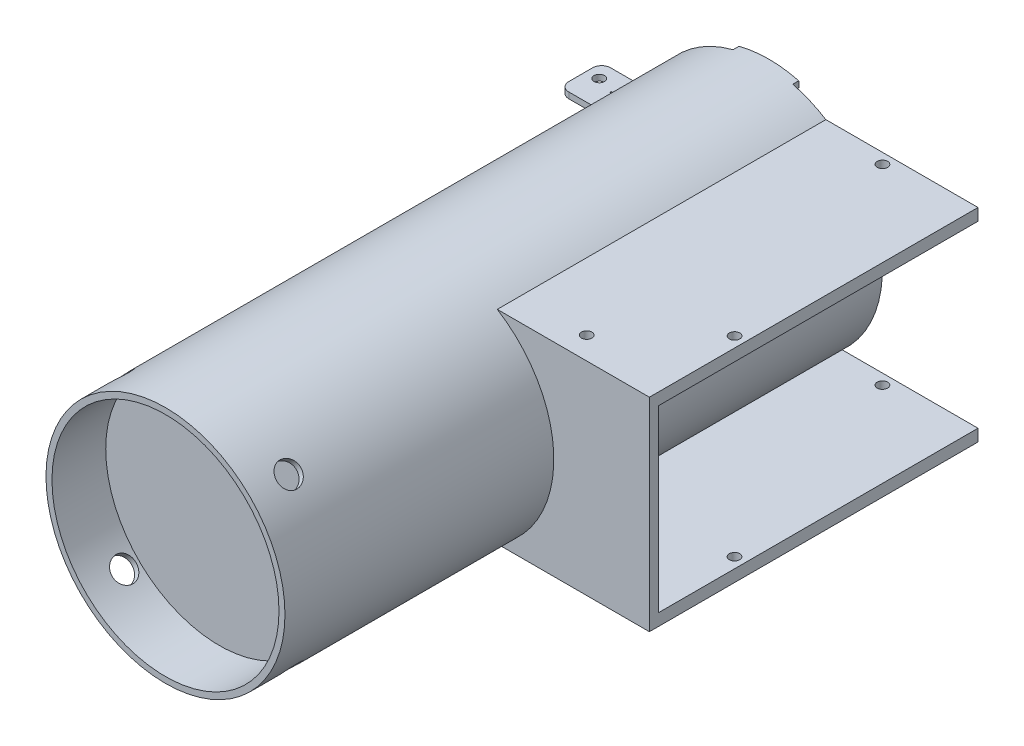
from build123d import *
from build123d.topology import SkipClean

# Parameters (mm, degrees)
SKETCH1_R                      = 40
SKETCH1_R_2                    = 38
BOSS_EXTRUDE1_DEPTH            = 200
SKETCH2_R                      = 40
BOSS_EXTRUDE2_DEPTH            = 2
BOSS_EXTRUDE3_DEPTH            = 107
BOSS_EXTRUDE4_DEPTH            = 3
SKETCH5_R                      = 1.75
CUT_EXTRUDE1_DEPTH             = 226.077764339
CUT_EXTRUDE2_REACH             = 218.296
SKETCH6_R                      = 4
CUT_EXTRUDE2_DIRECTION_2_REACH = 218.296
CIRPATTERN1_COUNT              = 2
CIRPATTERN1_ANGLE              = 90
BOSS_EXTRUDE5_REACH            = 241.742
BOSS_EXTRUDE5_END_RADIUS       = 40
SKETCH7_W                      = 14
SKETCH7_H                      = 2
CUT_EXTRUDE3_REACH             = 221.073
SKETCH8_R                      = 1.75
FILLET1_R                      = 3
CUT_EXTRUDE4_REACH             = 220.598
SKETCH9_R                      = 0.25
BOSS_EXTRUDE6_START            = 2
BOSS_EXTRUDE6_DEPTH            = 2


with BuildPart() as part:
    # Sketch1 → Boss-Extrude1 (new body)
    with BuildSketch(Plane.XY):
        Circle(SKETCH1_R)
        Circle(SKETCH1_R_2, mode=Mode.SUBTRACT)
    extrude(amount=BOSS_EXTRUDE1_DEPTH)

    # Sketch2 → Boss-Extrude2 (add)
    with BuildSketch(Plane.XY.offset(180)):
        Circle(SKETCH2_R)
    extrude(amount=BOSS_EXTRUDE2_DEPTH)

    # Sketch3 → Boss-Extrude3 (add)
    with BuildSketch(Plane(origin=(0, 0, 0), x_dir=(-1, 0, 0), z_dir=(0, 0, -1))):
        with BuildLine():
            Line((-21.071307506, -34), (-72, -34))
            Line((-72, -34), (-72, -30))
            Line((-72, -30), (-26.457513111, -30))
            ThreePointArc((-26.457513111, -30), (-23.848421275, -32.113125085), (-21.071307506, -34))
        make_face()
        with BuildLine():
            Line((-21.071307506, 34), (-72, 34))
            Line((-72, 34), (-72, 30))
            Line((-72, 30), (-26.457513111, 30))
            ThreePointArc((-26.457513111, 30), (-23.848421275, 32.113125085), (-21.071307506, 34))
        make_face()
    extrude(amount=-BOSS_EXTRUDE3_DEPTH)

    # Sketch4 → Boss-Extrude4 (add)
    with BuildSketch(Plane.XY.offset(107)):
        with BuildLine():
            Line((72, -34), (21.071307506, -34))
            ThreePointArc((21.071307506, -34), (40, 0), (21.071307506, 34))
            Line((21.071307506, 34), (72, 34))
            Line((72, 34), (72, -34))
        make_face()
    extrude(amount=BOSS_EXTRUDE4_DEPTH)

    # Sketch5 → Cut-Extrude1 (cut, through all)
    with BuildSketch(Plane(origin=(0, 34, 0), x_dir=(1, 0, 0), z_dir=(0, 1, 0))):
        with Locations(Location((43.5, -102.5, 0), (0, 0, 270))):
            Circle(SKETCH5_R)
        with Locations(Location((43.5, -3.5, 0), (0, 0, 270))):
            Circle(SKETCH5_R)
        with Locations(Location((68.5, -78, 0), (0, 0, 270))):
            Circle(SKETCH5_R)
    extrude(amount=-CUT_EXTRUDE1_DEPTH, mode=Mode.SUBTRACT)

    # Sketch6 → Cut-Extrude2 (cut, up to next)
    with BuildSketch(Plane(origin=(0, 0, 0), x_dir=(0, 0, 1), z_dir=(-0.7071067811865488, 0.7071067811865464, 0)), mode=Mode.PRIVATE) as cut_extrude2_sk1:
        with Locations(Location((187, 0, 0), (0, 0, 90))):
            Circle(SKETCH6_R)
    cut_extrude2_tool1 = extrude(cut_extrude2_sk1.sketch, amount=-CUT_EXTRUDE2_REACH, mode=Mode.PRIVATE) & part.part
    cut_extrude2 = cut_extrude2_tool1.solids().sort_by_distance((0, 0, 187))[0]
    add(cut_extrude2, mode=Mode.SUBTRACT)

    # Sketch6 → Cut-Extrude2 direction 2 (cut, up to next)
    with BuildSketch(Plane(origin=(0, 0, 0), x_dir=(0, 0, 1), z_dir=(-0.7071067811865488, 0.7071067811865464, 0)), mode=Mode.PRIVATE) as cut_extrude2_direction_2_sk1:
        with Locations(Location((187, 0, 0), (0, 0, 90))):
            Circle(SKETCH6_R)
    cut_extrude2_direction_2_tool1 = extrude(cut_extrude2_direction_2_sk1.sketch, amount=CUT_EXTRUDE2_DIRECTION_2_REACH, mode=Mode.PRIVATE) & part.part
    cut_extrude2_direction_2 = cut_extrude2_direction_2_tool1.solids().sort_by_distance((0, 0, 187))[0]
    add(cut_extrude2_direction_2, mode=Mode.SUBTRACT)

    # CirPattern1: Cut-Extrude2, Cut-Extrude2 direction 2 ×2 about axis
    cirpattern1_axis = Axis((0, 0, 106.8), (0, 0, 1))
    add([cut_extrude2.rotate(cirpattern1_axis, i * CIRPATTERN1_ANGLE / (CIRPATTERN1_COUNT - 1)) for i in range(1, CIRPATTERN1_COUNT)], mode=Mode.SUBTRACT)
    add([cut_extrude2_direction_2.rotate(cirpattern1_axis, i * CIRPATTERN1_ANGLE / (CIRPATTERN1_COUNT - 1)) for i in range(1, CIRPATTERN1_COUNT)], mode=Mode.SUBTRACT)

    # Boss-Extrude5: up to this cylinder (the profile starts outside it)
    boss_extrude5_end = Plane(origin=(0, 0, 7), z_dir=(0, 0, -1)) * Cylinder(BOSS_EXTRUDE5_END_RADIUS, 564.484, mode=Mode.PRIVATE)
    # Sketch7 → Boss-Extrude5 (add, up to the surface)
    with BuildSketch(Plane(origin=(-54, 0, 0), x_dir=(0, 0, -1), z_dir=(1, 0, 0)), mode=Mode.PRIVATE) as boss_extrude5_sk1:
        with Locations((-7, -12)):
            Rectangle(SKETCH7_W, SKETCH7_H)
    boss_extrude5_tool1 = extrude(boss_extrude5_sk1.sketch, amount=BOSS_EXTRUDE5_REACH, mode=Mode.PRIVATE) - boss_extrude5_end
    add(boss_extrude5_tool1.solids().sort_by_distance((-54, -12, 7))[0])
    # Sketch7 → Boss-Extrude5 (add, up to the surface)
    with BuildSketch(Plane(origin=(-54, 0, 0), x_dir=(0, 0, -1), z_dir=(1, 0, 0)), mode=Mode.PRIVATE) as boss_extrude5_sk2:
        with Locations((-7, 12)):
            Rectangle(SKETCH7_W, SKETCH7_H)
    boss_extrude5_tool2 = extrude(boss_extrude5_sk2.sketch, amount=BOSS_EXTRUDE5_REACH, mode=Mode.PRIVATE) - boss_extrude5_end
    add(boss_extrude5_tool2.solids().sort_by_distance((-54, 12, 7))[0])

    # Cut-Extrude3: up to this face of the body (flat: up to its plane)
    cut_extrude3_end = Plane(part.part.faces().sort_by_distance((-45.914280319, 13, 7))[0])
    # Sketch8 → Cut-Extrude3 (cut, up to the picked face)
    with BuildSketch(Plane.XZ.offset(13), mode=Mode.PRIVATE) as cut_extrude3_sk1:
        with Locations(Location((-49.770305539, 5.008755099, 0), (0, 0, 270))):
            Circle(SKETCH8_R)
    cut_extrude3_tool1 = split(extrude(cut_extrude3_sk1.sketch, amount=-CUT_EXTRUDE3_REACH, mode=Mode.PRIVATE), bisect_by=cut_extrude3_end, keep=Keep.BOTH, mode=Mode.PRIVATE)
    add(cut_extrude3_tool1.solids().sort_by(Axis((-49.770306, -13, 5.008755), (0, 1, 0)))[0], mode=Mode.SUBTRACT)

    # Fillet1
    fillet1_edges = [part.edges().sort_by_distance(p)[0] for p in [
        (-54, -12, 14),
        (-54, -12, 0),
        (-54, 12, 0),
        (-54, 12, 14),
    ]]
    fillet(fillet1_edges, radius=FILLET1_R)

    # Sketch9 → Cut-Extrude4 (cut, up to next)
    with BuildSketch(Plane.XZ.offset(-11), mode=Mode.PRIVATE) as cut_extrude4_sk1:
        with Locations(Location((-43.770305539, 7.008755099, 0), (0, 0, 270))):
            Circle(SKETCH9_R)
    cut_extrude4_tool1 = extrude(cut_extrude4_sk1.sketch, amount=-CUT_EXTRUDE4_REACH, mode=Mode.PRIVATE) & part.part
    add(cut_extrude4_tool1.solids().sort_by_distance((-43.770306, 11, 7.008755))[0], mode=Mode.SUBTRACT)

    # Sketch10 → Boss-Extrude6 (add)
    with SkipClean():  # the faces are left unmerged after this step: merging them gives an invalid solid
        with BuildSketch(Plane(origin=(0, 0, 0), x_dir=(-1, 0, 0), z_dir=(0, 0, -1)).offset(BOSS_EXTRUDE6_START)):
            with BuildLine():
                ThreePointArc((10, -36.66060556), (0, -38), (-10, -36.66060556))
                Line((-10, -36.66060556), (-10, -38.729833462))
                ThreePointArc((-10, -38.729833462), (0, -40), (10, -38.729833462))
                Line((10, -38.729833462), (10, -36.66060556))
            make_face()
            with BuildLine():
                ThreePointArc((10, 38.729833462), (0, 40), (-10, 38.729833462))
                Line((-10, 38.729833462), (-10, 36.66060556))
                ThreePointArc((-10, 36.66060556), (0, 38), (10, 36.66060556))
                Line((10, 36.66060556), (10, 38.729833462))
            make_face()
        extrude(amount=-BOSS_EXTRUDE6_DEPTH)


solid = part.part
